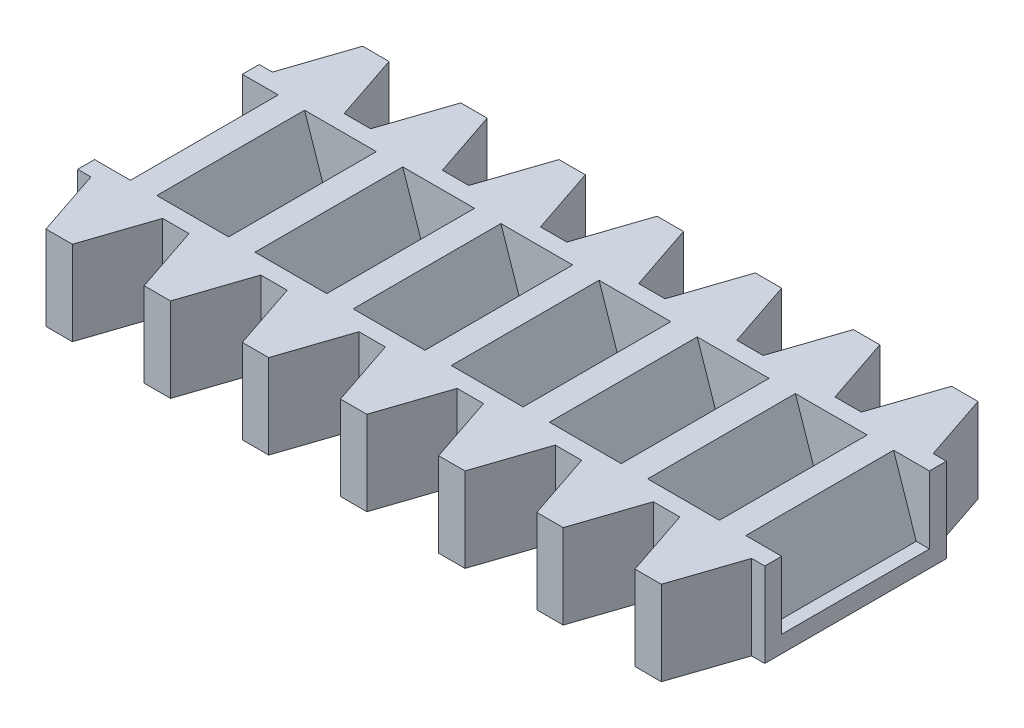
from build123d import *

# Parameters (mm, degrees)
SKETCH_1_W                    = 4.65
SKETCH_1_H                    = 8.6
EXTRUDE_1_DEPTH               = 4
EXTRUDE_2_DEPTH               = 4
CUT_EXTRUDE_1_DEPTH           = 3.5
PATTERN_LINEAR_4_COUNT        = 7
PATTERN_LINEAR_4_PITCH        = 4.65
PATTERN_LINEAR_4_COPY_1_DEPTH = 4
PATTERN_LINEAR_4_COPY_2_DEPTH = 4
PATTERN_LINEAR_4_COPY_3_DEPTH = 4
PATTERN_LINEAR_4_COPY_4_DEPTH = 4
PATTERN_LINEAR_4_COPY_5_DEPTH = 4
PATTERN_LINEAR_4_COPY_6_DEPTH = 4
EXTRUDE_START                 = 1
EXTRUDE_4_DEPTH               = 25.9
FILLET_1_R                    = 0.1


with BuildPart() as part:
    # 草图1 → 凸台-拉伸1 (new body)
    with BuildSketch(Plane(origin=(0, 0, 0), x_dir=(1, 0, 0), z_dir=(0, 1, 0))):
        Rectangle(SKETCH_1_W, SKETCH_1_H)
    extrude_1 = extrude(amount=EXTRUDE_1_DEPTH)

    # 草图3 → 凸台-拉伸2 (add)
    with BuildSketch(Plane(origin=(0, 0, 0), x_dir=(1, 0, 0), z_dir=(0, 1, 0))):
        Polygon((0.625, 7.5), (-0.625, 7.5), (-1.7, 4.3), (1.7, 4.3), align=None)
    extrude_2 = extrude(amount=EXTRUDE_2_DEPTH)

    # 镜向1: 凸台-拉伸2 across plane
    add(extrude_2.mirror(Plane.XY))

    # 草图4 → 切除-拉伸1 (cut, symmetric)
    with BuildSketch(Plane.XY):
        Polygon((-0.625, 4), (-2.325, 4), (-2.325, 0.8), (-1.7, 0.8), align=None)
        Polygon((1.7, 0.8), (2.325, 0.8), (2.325, 4), (0.625, 4), align=None)
    cut_extrude_1 = extrude(amount=CUT_EXTRUDE_1_DEPTH, both=True, mode=Mode.SUBTRACT)

    # 阵列(线性)4: 凸台-拉伸1, 凸台-拉伸2, 切除-拉伸1 ×7
    with Locations(*[(i * PATTERN_LINEAR_4_PITCH, 0, 0) for i in range(1, PATTERN_LINEAR_4_COUNT)]):
        add(extrude_1)
        add(extrude_2)
        add(cut_extrude_1, mode=Mode.SUBTRACT)

    # 阵列(线性)4 copy 1 sketch → 阵列(线性)4 copy 1 (add)
    with BuildSketch(Plane(origin=(4.65, 0, 0), x_dir=(1, 0, 0), z_dir=(0, 1, 0))):
        Polygon((0.625, -7.5), (-0.625, -7.5), (-1.7, -4.3), (1.7, -4.3), align=None)
    extrude(amount=PATTERN_LINEAR_4_COPY_1_DEPTH)

    # 阵列(线性)4 copy 2 sketch → 阵列(线性)4 copy 2 (add)
    with BuildSketch(Plane(origin=(9.3, 0, 0), x_dir=(1, 0, 0), z_dir=(0, 1, 0))):
        Polygon((0.625, -7.5), (-0.625, -7.5), (-1.7, -4.3), (1.7, -4.3), align=None)
    extrude(amount=PATTERN_LINEAR_4_COPY_2_DEPTH)

    # 阵列(线性)4 copy 3 sketch → 阵列(线性)4 copy 3 (add)
    with BuildSketch(Plane(origin=(13.95, 0, 0), x_dir=(1, 0, 0), z_dir=(0, 1, 0))):
        Polygon((0.625, -7.5), (-0.625, -7.5), (-1.7, -4.3), (1.7, -4.3), align=None)
    extrude(amount=PATTERN_LINEAR_4_COPY_3_DEPTH)

    # 阵列(线性)4 copy 4 sketch → 阵列(线性)4 copy 4 (add)
    with BuildSketch(Plane(origin=(18.6, 0, 0), x_dir=(1, 0, 0), z_dir=(0, 1, 0))):
        Polygon((0.625, -7.5), (-0.625, -7.5), (-1.7, -4.3), (1.7, -4.3), align=None)
    extrude(amount=PATTERN_LINEAR_4_COPY_4_DEPTH)

    # 阵列(线性)4 copy 5 sketch → 阵列(线性)4 copy 5 (add)
    with BuildSketch(Plane(origin=(23.25, 0, 0), x_dir=(1, 0, 0), z_dir=(0, 1, 0))):
        Polygon((0.625, -7.5), (-0.625, -7.5), (-1.7, -4.3), (1.7, -4.3), align=None)
    extrude(amount=PATTERN_LINEAR_4_COPY_5_DEPTH)

    # 阵列(线性)4 copy 6 sketch → 阵列(线性)4 copy 6 (add)
    with BuildSketch(Plane(origin=(27.9, 0, 0), x_dir=(1, 0, 0), z_dir=(0, 1, 0))):
        Polygon((0.625, -7.5), (-0.625, -7.5), (-1.7, -4.3), (1.7, -4.3), align=None)
    extrude(amount=PATTERN_LINEAR_4_COPY_6_DEPTH)

    # 草图6 → 凸台-拉伸4 (add)
    with BuildSketch(Plane(origin=(0, 0, 0), x_dir=(0, 0, -1), z_dir=(1, 0, 0)).offset(EXTRUDE_START)):
        with BuildLine():
            Line((1.5, 0), (0.5, 0))
            Line((0.5, 0), (0.5, -1.07225346))
            Line((0.5, -1.07225346), (1.165769145, -2.5))
            Line((1.165769145, -2.5), (1.95, -2.5))
            Line((1.95, -2.5), (1.95, -1.555590279))
            ThreePointArc((1.95, -1.555590279), (1.780042303, -1.088161527), (1.5, -0.677124344))
            Line((1.5, -0.677124344), (1.5, 0))
        make_face()
        with BuildLine():
            Line((-0.5, -1.07225346), (-1.165769145, -2.5))
            Line((-1.165769145, -2.5), (-1.95, -2.5))
            Line((-1.95, -2.5), (-1.95, -1.555590279))
            ThreePointArc((-1.95, -1.555590279), (-1.780042303, -1.088161527), (-1.5, -0.677124344))
            Line((-1.5, -0.677124344), (-1.5, 0))
            Line((-1.5, 0), (-0.5, 0))
            Line((-0.5, 0), (-0.5, -1.07225346))
        make_face()
    extrude(amount=EXTRUDE_4_DEPTH)

    # 圆角1
    fillet_1_edges = [part.edges().sort_by_distance(p)[0] for p in [
        (1, -2.5, -1.557884573),
        (13.95, -2.5, -1.165769145),
        (13.95, -2.5, -1.95),
        (26.9, -2.5, -1.557884573),
        (1, -2.5, 1.557884573),
        (13.95, -2.5, 1.95),
        (13.95, -2.5, 1.165769145),
        (26.9, -2.5, 1.557884573),
    ]]
    fillet(fillet_1_edges, radius=FILLET_1_R)


solid = part.part
